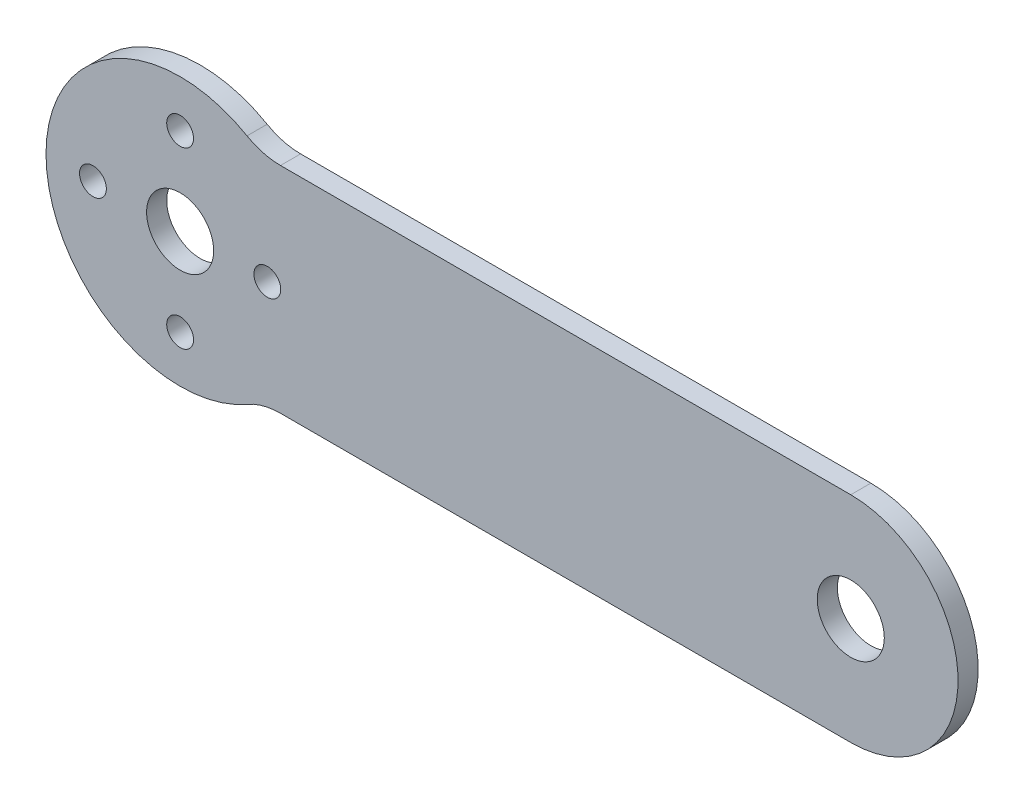
from build123d import *

# Parameters (mm, degrees)
EXTRUDE_1_DEPTH     = 3
SKETCH_2_R          = 20
EXTRUDE_2_DEPTH     = 3
FILLET_1_R          = 10
SKETCH_3_R          = 2
SKETCH_3_R_2        = 5
CUT_EXTRUDE_1_DEPTH = 3


with BuildPart() as part:
    # 草图1 → 凸台-拉伸1 (new body)
    with BuildSketch(Plane.XY):
        with BuildLine():
            Line((0, 16), (100, 16))
            ThreePointArc((100, 16), (116, 0), (100, -16))
            Line((100, -16), (0, -16))
            ThreePointArc((0, -16), (-16, 0), (0, 16))
        make_face()
    extrude(amount=EXTRUDE_1_DEPTH)

    # 草图2 → 凸台-拉伸2 (add)
    with BuildSketch(Plane.XY.offset(3)):
        Circle(SKETCH_2_R)
    extrude(amount=-EXTRUDE_2_DEPTH)

    # 圆角1
    fillet_1_edges = [part.edges().sort_by_distance(p)[0] for p in [
        (12, -16, 1.5),
        (12, 16, 1.5),
    ]]
    fillet(fillet_1_edges, radius=FILLET_1_R)

    # 草图3 → 切除-拉伸1 (cut)
    with BuildSketch(Plane.XY.offset(3)):
        with Locations((0, 13)):
            Circle(SKETCH_3_R)
        with Locations((13, 0)):
            Circle(SKETCH_3_R)
        with Locations((0, -13)):
            Circle(SKETCH_3_R)
        with Locations((-13, 0)):
            Circle(SKETCH_3_R)
        Circle(SKETCH_3_R_2)
        with Locations((100, 0)):
            Circle(SKETCH_3_R_2)
    extrude(amount=-CUT_EXTRUDE_1_DEPTH, mode=Mode.SUBTRACT)


solid = part.part
